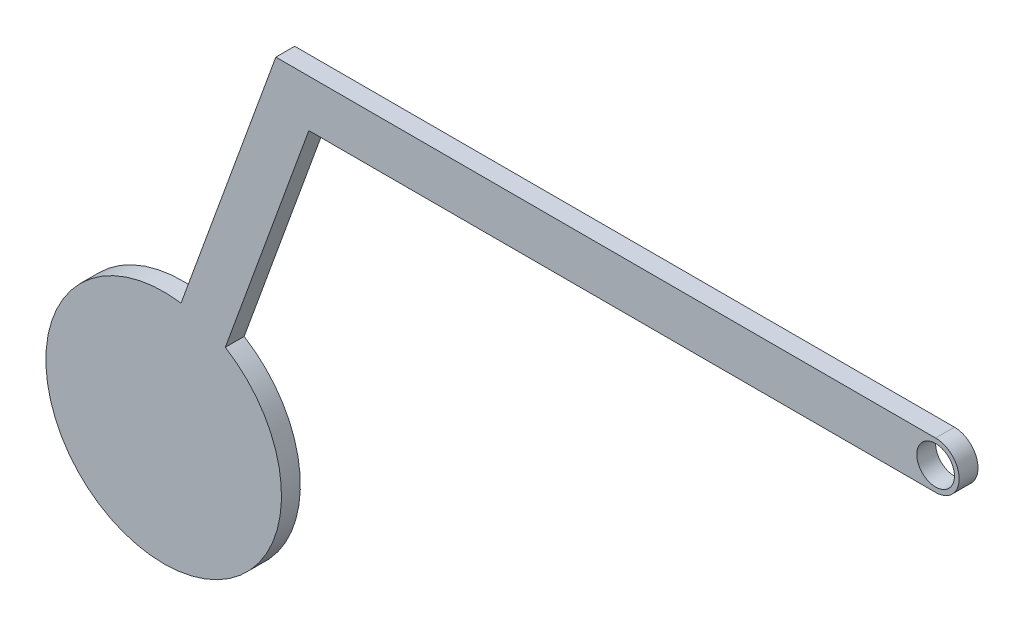
from build123d import *

# Parameters (mm, degrees)
BOSS_EXTRUDE1_DEPTH = 2
SKETCH4_R           = 2
CUT_EXTRUDE1_DEPTH  = 5


with BuildPart() as part:
    # Sketch1 → Boss-Extrude1 (new body)
    with BuildSketch(Plane.XY):
        with BuildLine():
            Line((9.503526384, 33.420205662), (11.898379024, 40))
            Line((11.898379024, 40), (18.900451053, 40))
            Line((18.900451053, 40), (81.898379024, 40))
            ThreePointArc((81.898379024, 40), (84.398379024, 37.5), (81.898379024, 35))
            Line((81.898379024, 35), (22.362429948, 35))
            Line((22.362429948, 35), (15.399415038, 35))
            Line((15.399415038, 35), (13.292753309, 29.212002571))
            Line((13.292753309, 29.212002571), (6.538105716, 10.653786822))
            ThreePointArc((6.538105716, 10.653786822), (-4.275251792, -11.74615776), (1.839642613, 12.363887538))
            Line((1.839642613, 12.363887538), (9.503526384, 33.420205662))
        make_face()
    extrude(amount=BOSS_EXTRUDE1_DEPTH)

    # Sketch4 → Cut-Extrude1 (cut)
    with BuildSketch(Plane.XY.offset(2)):
        with Locations((81.898379024, 37.5)):
            Circle(SKETCH4_R)
    extrude(amount=-CUT_EXTRUDE1_DEPTH, mode=Mode.SUBTRACT)


solid = part.part
